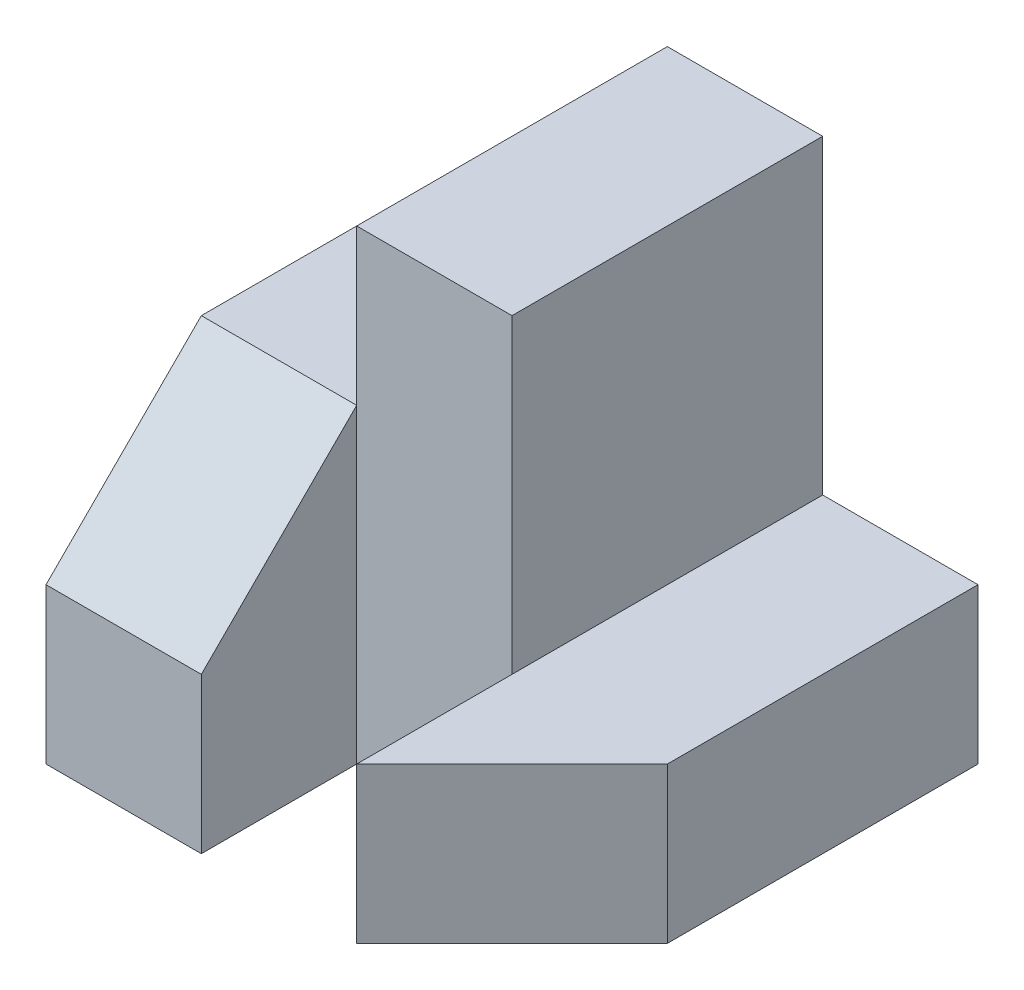
from build123d import *

# Parameters (mm, degrees)
SKETCH_1_W           = 30
SKETCH_1_H           = 30
EXTRUDE_1_DEPTH      = 30
SKETCH_30_W          = 10
SKETCH_30_H          = 10
SKETCH_30_H_2        = 20
CUT_EXTRUDE_20_DEPTH = 52.961524227
SKETCH_32_W          = 10
SKETCH_32_H          = 10
CUT_EXTRUDE_21_DEPTH = 47.904157598
SKETCH_33_W          = 10
SKETCH_33_H          = 10
CUT_EXTRUDE_22_DEPTH = 52.961524227


with BuildPart() as part:
    # 草圖1 → 填料-伸1 (new body)
    with BuildSketch(Plane.XY):
        with Locations((15, 15)):
            Rectangle(SKETCH_1_W, SKETCH_1_H)
    extrude(amount=-EXTRUDE_1_DEPTH)

    # 草圖30 → 除料-伸長20 (cut, through all)
    with BuildSketch(Plane.XY):
        with Locations((5, 25)):
            Rectangle(SKETCH_30_W, SKETCH_30_H)
        with Locations((25, 20)):
            Rectangle(SKETCH_30_W, SKETCH_30_H_2)
    extrude(amount=-CUT_EXTRUDE_20_DEPTH, mode=Mode.SUBTRACT)

    # 草圖32 → 除料-伸長21 (cut, through all)
    with BuildSketch(Plane(origin=(20, 0, 0), x_dir=(0, 0, -1), z_dir=(1, 0, 0))):
        with Locations((5, 25)):
            Rectangle(SKETCH_32_W, SKETCH_32_H)
        Polygon((0, 10), (10, 20), (0, 20), align=None)
    extrude(amount=-CUT_EXTRUDE_21_DEPTH, mode=Mode.SUBTRACT)

    # 草圖33 → 除料-伸長22 (cut, through all)
    with BuildSketch(Plane(origin=(0, 30, 0), x_dir=(1, 0, 0), z_dir=(0, 1, 0))):
        with Locations((15, 5)):
            Rectangle(SKETCH_33_W, SKETCH_33_H)
        Polygon((30, 10), (20, 0), (30, 0), align=None)
    extrude(amount=-CUT_EXTRUDE_22_DEPTH, mode=Mode.SUBTRACT)


solid = part.part
